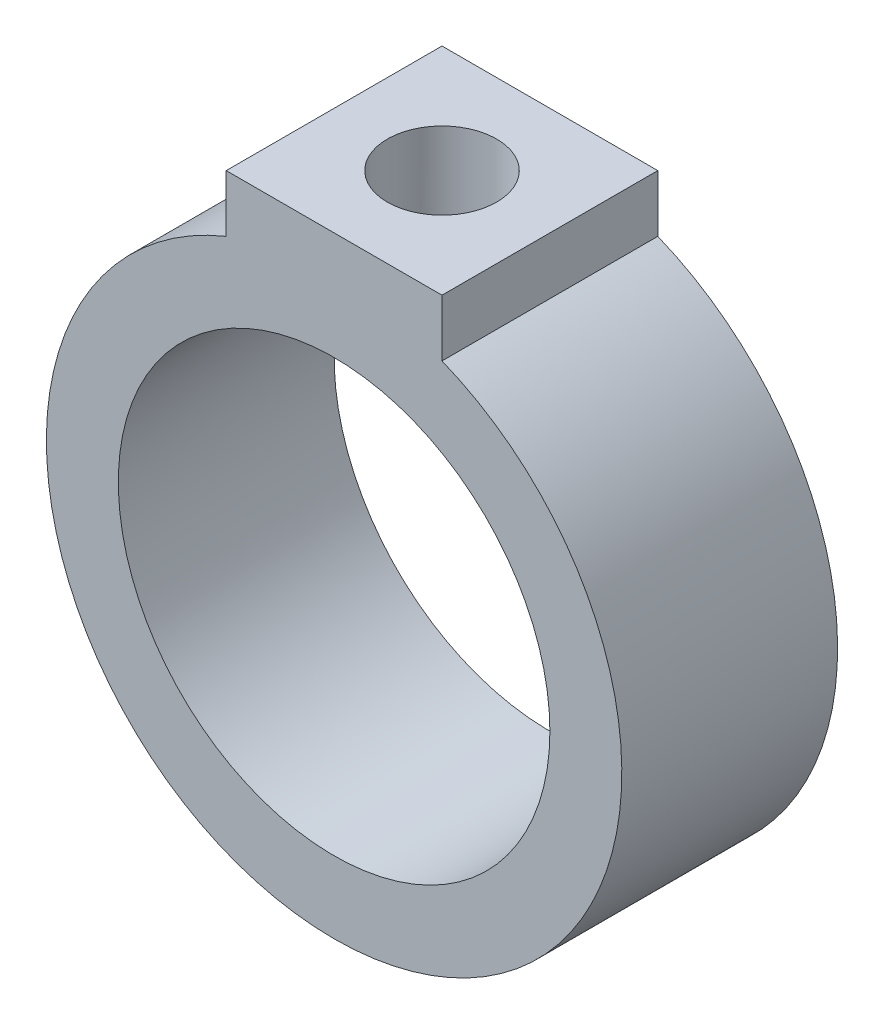
from build123d import *

# Parameters (mm, degrees)
SKETCH1_R               = 25.4
BOSS_EXTRUDE1_DEPTH     = 9.525
SKETCH2_W               = 19.05
SKETCH2_H               = 19.05
BOSS_EXTRUDE2_DEPTH     = 28.575
SKETCH3_R               = 19.05
CUT_EXTRUDE1_DEPTH      = 43.715256349
CUT_EXTRUDE2_REACH      = 62.408
CUT_EXTRUDE2_END_RADIUS = 19.05
SKETCH4_R               = 4.826


with BuildPart() as part:
    # Sketch1 → Boss-Extrude1 (new, symmetric)
    with BuildSketch(Plane.XY):
        with Locations(Location((0, 0, 0), (0, 0, 180))):
            Circle(SKETCH1_R)
    extrude(amount=BOSS_EXTRUDE1_DEPTH, both=True)

    # Sketch2 → Boss-Extrude2 (add)
    with BuildSketch(Plane(origin=(0, 0, 0), x_dir=(1, 0, 0), z_dir=(0, 1, 0))):
        Rectangle(SKETCH2_W, SKETCH2_H)
    extrude(amount=BOSS_EXTRUDE2_DEPTH)

    # Sketch3 → Cut-Extrude1 (cut, through all)
    with BuildSketch(Plane.XY.offset(9.525)):
        Circle(SKETCH3_R)
    extrude(amount=-CUT_EXTRUDE1_DEPTH, mode=Mode.SUBTRACT)

    # Cut-Extrude2: up to this cylinder (the profile starts outside it)
    cut_extrude2_end = Plane(origin=(0, 0, 0), z_dir=(0, 0, 1)) * Cylinder(CUT_EXTRUDE2_END_RADIUS, 163.916, mode=Mode.PRIVATE)
    # Sketch4 → Cut-Extrude2 (cut, up to the surface)
    with BuildSketch(Plane(origin=(0, 28.575, 0), x_dir=(1, 0, 0), z_dir=(0, 1, 0)), mode=Mode.PRIVATE) as cut_extrude2_sk1:
        with Locations(Location((0, 0, 0), (0, 0, 270))):
            Circle(SKETCH4_R)
    cut_extrude2_tool1 = extrude(cut_extrude2_sk1.sketch, amount=-CUT_EXTRUDE2_REACH, mode=Mode.PRIVATE) - cut_extrude2_end
    add(cut_extrude2_tool1.solids().sort_by_distance((0, 28.575, 0))[0], mode=Mode.SUBTRACT)


solid = part.part
